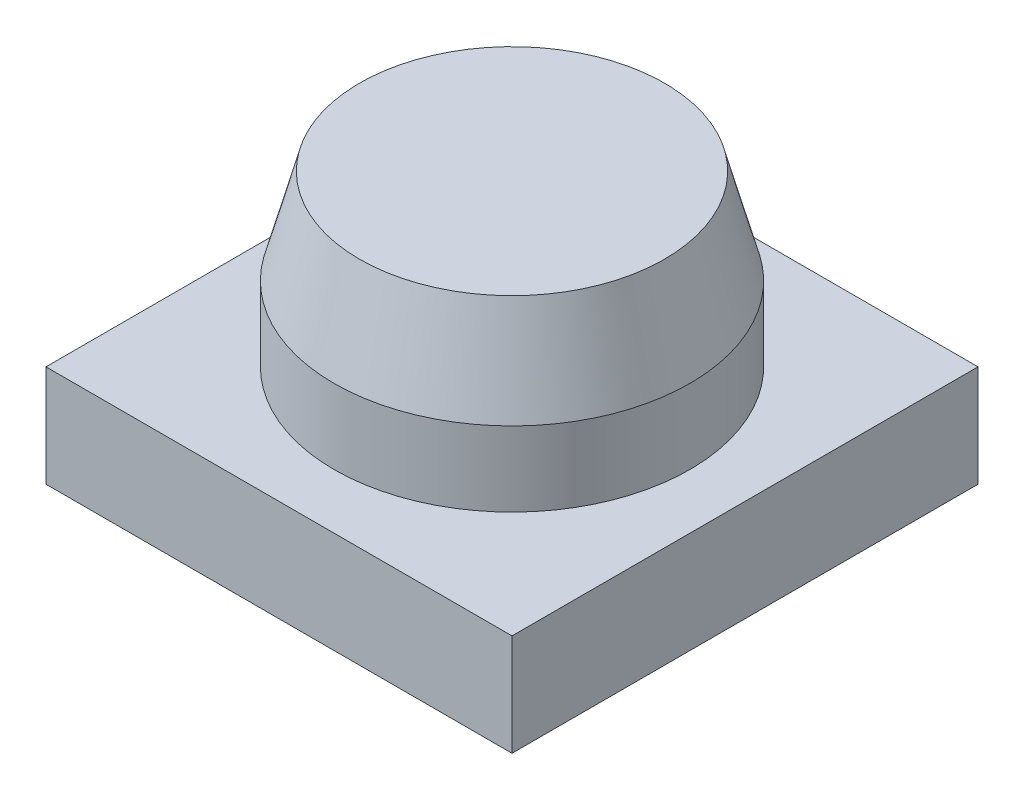
from build123d import *

# Parameters (mm, degrees)
SKETCH1_W           = 5.5
SKETCH1_H           = 5.5
BOSS_EXTRUDE1_DEPTH = 1.2
SKETCH2_R           = 2.1
BOSS_EXTRUDE2_DEPTH = 2
SKETCH3_R           = 1.95
CUT_EXTRUDE1_DEPTH  = 0.9
CHAMFER2_SIZE       = 0.3
CHAMFER2_SIZE2      = 1.119615242


with BuildPart() as part:
    # Sketch1 → Boss-Extrude1 (new body)
    with BuildSketch(Plane(origin=(0, 0, 0), x_dir=(1, 0, 0), z_dir=(0, 1, 0))):
        Rectangle(SKETCH1_W, SKETCH1_H)
    extrude(amount=BOSS_EXTRUDE1_DEPTH)

    # Sketch2 → Boss-Extrude2 (add)
    with BuildSketch(Plane(origin=(0, 1.2, 0), x_dir=(1, 0, 0), z_dir=(0, 1, 0))):
        with Locations(Location((0, 0, 0), (0, 0, 270))):
            Circle(SKETCH2_R)
    extrude(amount=BOSS_EXTRUDE2_DEPTH)

    # Sketch3 → Cut-Extrude1 (cut)
    with BuildSketch(Plane.XZ):
        with Locations(Location((0, 0, 0), (0, 0, 270))):
            Circle(SKETCH3_R)
    extrude(amount=-CUT_EXTRUDE1_DEPTH, mode=Mode.SUBTRACT)

    # Chamfer2
    chamfer2_edges = [part.edges().sort_by_distance(p)[0] for p in [
        (0, 3.2, -2.1),
    ]]
    chamfer2_side = [part.faces().sort_by_distance(p)[0] for p in [
        (0, 3.2, 0),
    ]]
    chamfer(chamfer2_edges, length=CHAMFER2_SIZE, length2=CHAMFER2_SIZE2, reference=chamfer2_side[0])


solid = part.part
